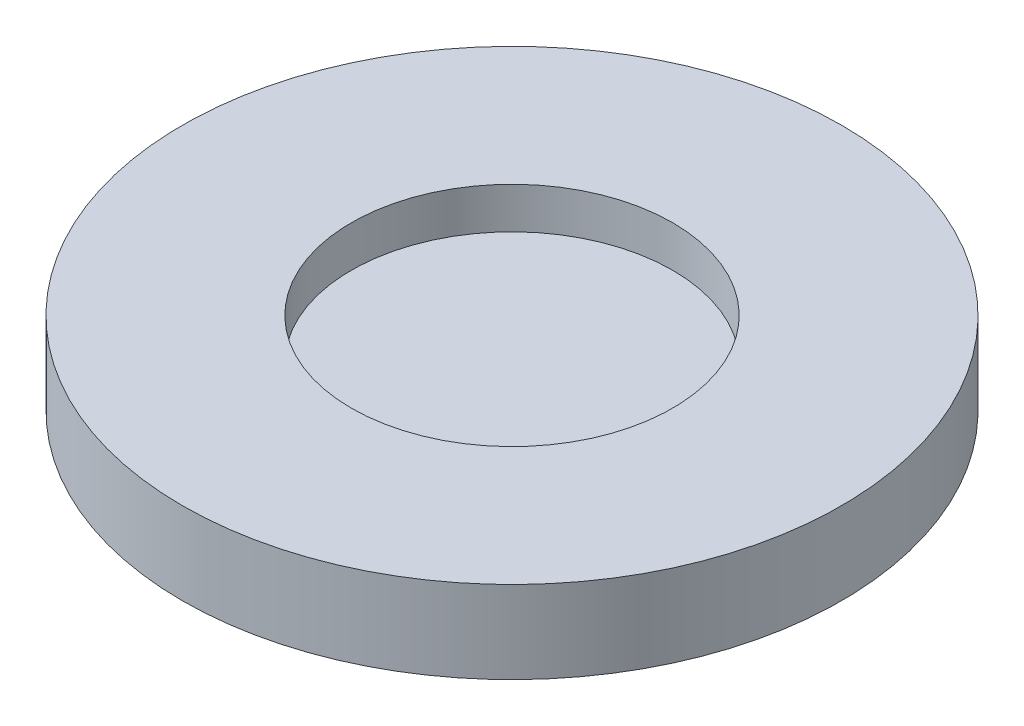
from build123d import *

# Parameters (mm, degrees)
SKETCH3_R           = 40
BOSS_EXTRUDE3_DEPTH = 10
SKETCH4_R           = 19.5
CUT_EXTRUDE1_DEPTH  = 5


with BuildPart() as part:
    # Sketch3 → Boss-Extrude3 (new body)
    with BuildSketch(Plane(origin=(0, 0, 0), x_dir=(1, 0, 0), z_dir=(0, 1, 0))):
        with Locations(Location((0, 0, 0), (0, 0, 270))):
            Circle(SKETCH3_R)
    extrude(amount=BOSS_EXTRUDE3_DEPTH)

    # Sketch4 → Cut-Extrude1 (cut)
    with BuildSketch(Plane(origin=(0, 10, 0), x_dir=(1, 0, 0), z_dir=(0, 1, 0))):
        with Locations(Location((0, 0, 0), (0, 0, 270))):
            Circle(SKETCH4_R)
    extrude(amount=-CUT_EXTRUDE1_DEPTH, mode=Mode.SUBTRACT)


solid = part.part
